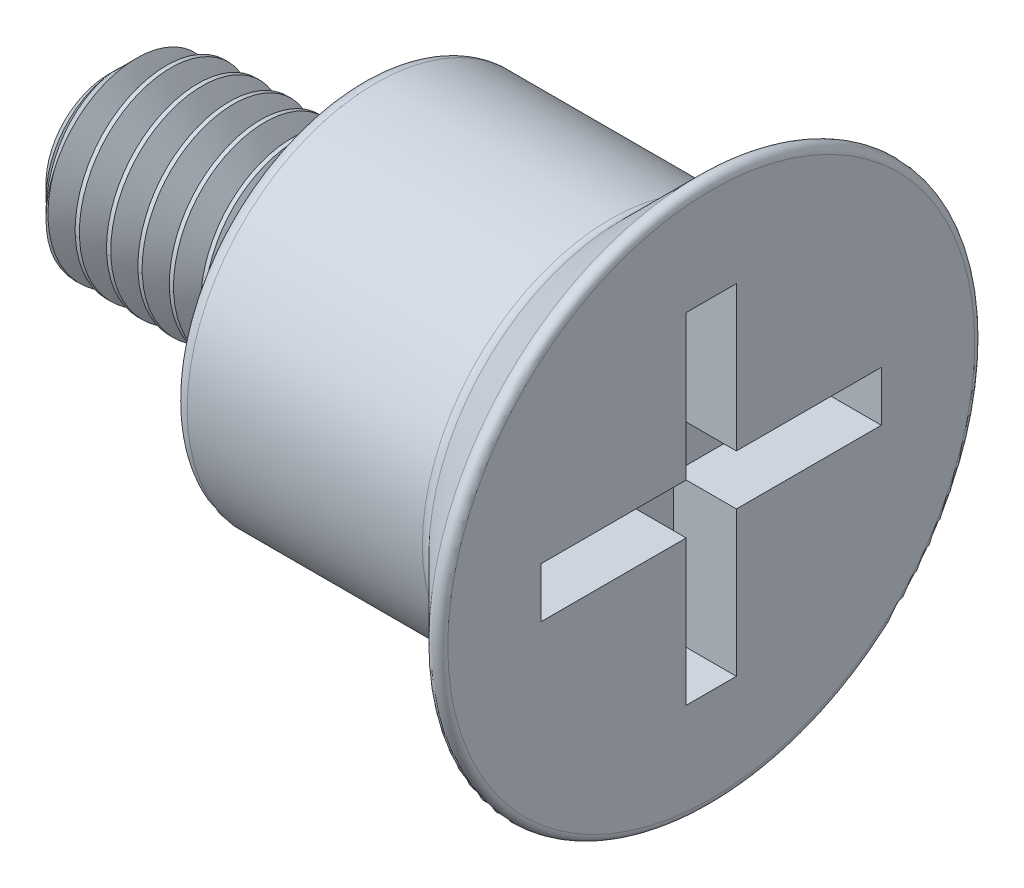
from build123d import *

# Parameters (mm, degrees)
SKETCH2_W              = 0.8
SKETCH2_H              = 2.309596762
SKETCH2_H_2            = 0.8
SKETCH2_W_2            = 2.309596762
CUT_EXTRUDE1_DEPTH     = 1
CHAMFER1_SIZE          = 0.5
FILLET1_R              = 0.25
FILLET2_R              = 0.125
CUT_SWEEP1_PITCH       = 0.5
CUT_SWEEP1_HEIGHT      = 3.5
CUT_SWEEP1_RADIUS      = 1.125
CUT_SWEEP1_START_ANGLE = 180


with BuildPart() as part:
    # Sketch1 → Revolve1 (revolve)
    with BuildSketch(Plane.XY, mode=Mode.PRIVATE) as revolve1_sk:
        Polygon((0, 0), (0, 4.5), (-1.5, 3), (-5.6, 3), (-5.6, 1.5), (-9.6, 1.5), (-9.6, 0), align=None)
    revolve(revolve1_sk.sketch.rotate(Axis((-26.731088436, 0, 0), (1, 0, 0)), 90), axis=Axis((-26.731088436, 0, 0), (1, 0, 0)))

    # Sketch2 → Cut-Extrude1 (cut)
    with BuildSketch(Plane(origin=(0, 0, 0), x_dir=(0, 0, -1), z_dir=(1, 0, 0))):
        with Locations((0, 1.554798381)):
            Rectangle(SKETCH2_W, SKETCH2_H)
        Rectangle(SKETCH2_W, SKETCH2_H_2)
        with Locations((1.554798381, 0)):
            Rectangle(SKETCH2_W_2, SKETCH2_H_2)
        with Locations((-1.554798381, 0)):
            Rectangle(SKETCH2_W_2, SKETCH2_H_2)
        with Locations((0, -1.554798381)):
            Rectangle(SKETCH2_W, SKETCH2_H)
    extrude(amount=-CUT_EXTRUDE1_DEPTH, mode=Mode.SUBTRACT)

    # Chamfer1
    chamfer1_edges = [part.edges().sort_by_distance(p)[0] for p in [
        (-9.6, 0, -1.5),
    ]]
    chamfer(chamfer1_edges, length=CHAMFER1_SIZE)

    # Fillet1
    fillet1_edges = [part.edges().sort_by_distance(p)[0] for p in [
        (-5.6, 0, -3),
        (-1.5, 0, -3),
    ]]
    fillet(fillet1_edges, radius=FILLET1_R)

    # Fillet2
    fillet2_edges = [part.edges().sort_by_distance(p)[0] for p in [
        (0, 0, -4.5),
    ]]
    fillet(fillet2_edges, radius=FILLET2_R)

    # Cut-Sweep1: sweep along a helix
    with BuildLine() as cut_sweep1_path:
        add(Helix(CUT_SWEEP1_PITCH, CUT_SWEEP1_HEIGHT, CUT_SWEEP1_RADIUS, center=(-9.6, 0, 0), direction=(1, 0, 0), mode=Mode.PRIVATE).rotate(Axis((-9.6, 0, 0), (1, 0, 0)), CUT_SWEEP1_START_ANGLE))
    # Sketch4 → Cut-Sweep1 (sweep, cut)
    with BuildSketch(Plane(origin=(0, 0, 0), x_dir=(1, 0, 0), z_dir=(0, 1, 0))):
        Polygon((-9.826581918, 1.517451394), (-9.373418082, 1.517451394), (-9.6, 1.125), align=None)
    sweep(path=cut_sweep1_path.line, is_frenet=True, mode=Mode.SUBTRACT)


solid = part.part
